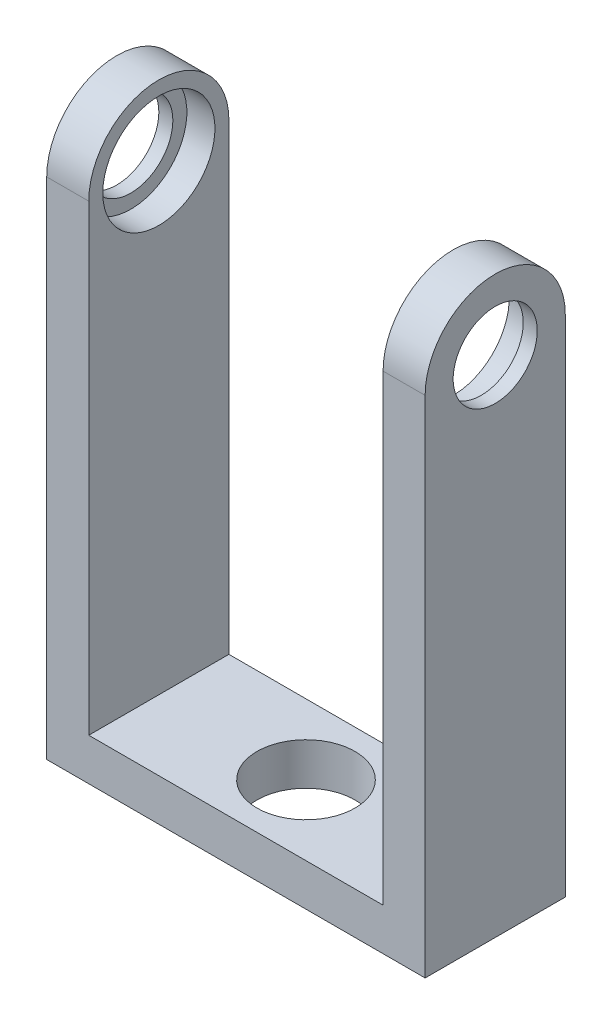
from build123d import *

# Parameters (mm, degrees)
SKETCH1_W           = 27
SKETCH1_H           = 10
BOSS_EXTRUDE1_DEPTH = 3
SKETCH5_R           = 3
BOSS_EXTRUDE3_DEPTH = 3
SKETCH6_R           = 1.5
CUT_EXTRUDE1_DEPTH  = 3
SKETCH7_R           = 4
CUT_EXTRUDE2_DEPTH  = 2
SKETCH8_R           = 3.5
CUT_EXTRUDE4_DEPTH  = 41.635575547


with BuildPart() as part:
    # Sketch1 → Boss-Extrude1 (new body)
    with BuildSketch(Plane(origin=(0, 0, 0), x_dir=(1, 0, 0), z_dir=(0, 1, 0))):
        Rectangle(SKETCH1_W, SKETCH1_H)
    boss_extrude1 = extrude(amount=BOSS_EXTRUDE1_DEPTH)

    # Sketch5 → Boss-Extrude3 (add)
    with BuildSketch(Plane(origin=(13.5, 0, 0), x_dir=(0, 0, -1), z_dir=(1, 0, 0))):
        with BuildLine():
            Line((-5, 3), (5, 3))
            Line((5, 3), (5, 36))
            ThreePointArc((5, 36), (0, 41), (-5, 36))
            Line((-5, 36), (-5, 3))
        make_face()
        with Locations((0, 36)):
            Circle(SKETCH5_R, mode=Mode.SUBTRACT)
    boss_extrude3 = extrude(amount=-BOSS_EXTRUDE3_DEPTH)

    # Sketch6 → Cut-Extrude1 (cut)
    with BuildSketch(Plane(origin=(0, 3, 0), x_dir=(1, 0, 0), z_dir=(0, 1, 0))):
        with Locations(Location((0, 0, 0), (0, 0, 270))):
            Circle(SKETCH6_R)
    extrude(amount=-CUT_EXTRUDE1_DEPTH, mode=Mode.SUBTRACT)

    # Sketch7 → Cut-Extrude2 (cut)
    with BuildSketch(Plane.ZY.offset(-10.5)):
        with Locations((0, 36)):
            Circle(SKETCH7_R)
    cut_extrude2 = extrude(amount=-CUT_EXTRUDE2_DEPTH, mode=Mode.SUBTRACT)

    # Mirror3: Boss-Extrude1, Boss-Extrude3, Cut-Extrude2 across plane
    add(boss_extrude1.mirror(Plane(origin=(0, 0, 0), x_dir=(0, 0, 1), z_dir=(1, 0, 0))))
    add(boss_extrude3.mirror(Plane(origin=(0, 0, 0), x_dir=(0, 0, 1), z_dir=(1, 0, 0))))
    add(cut_extrude2.mirror(Plane(origin=(0, 0, 0), x_dir=(0, 0, 1), z_dir=(1, 0, 0))), mode=Mode.SUBTRACT)

    # Sketch8 → Cut-Extrude4 (cut, through all)
    with BuildSketch(Plane(origin=(0, 3, 0), x_dir=(1, 0, 0), z_dir=(0, 1, 0))):
        with Locations(Location((0, 0, 0), (0, 0, 270))):
            Circle(SKETCH8_R)
    extrude(amount=-CUT_EXTRUDE4_DEPTH, mode=Mode.SUBTRACT)


solid = part.part
